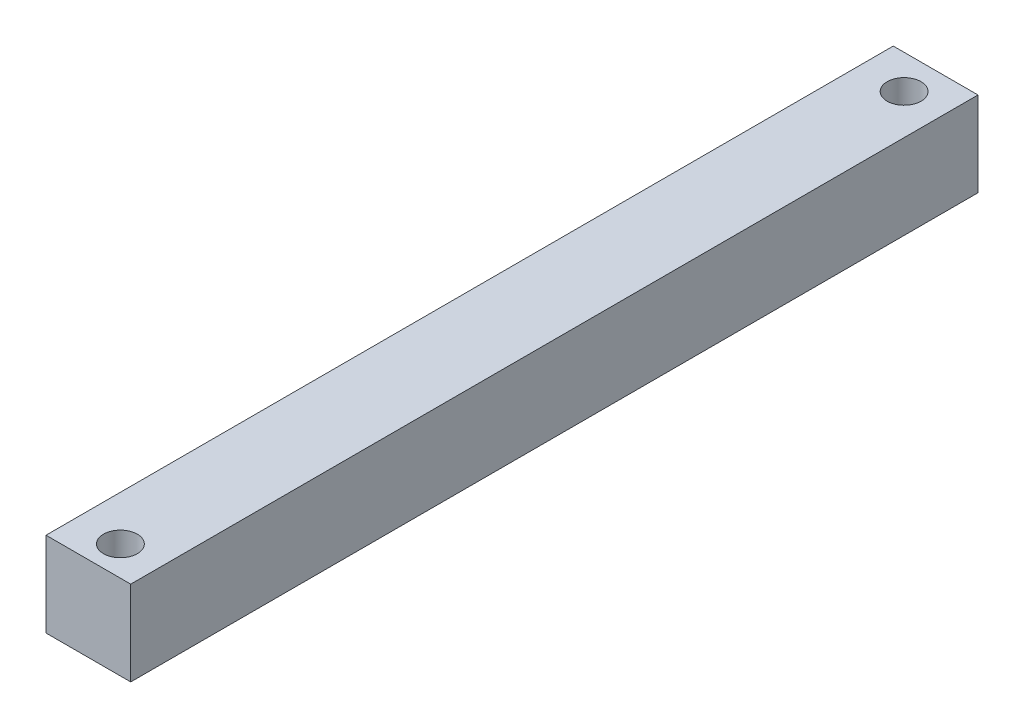
from build123d import *

# Parameters (mm, degrees)
SKETCH1_W           = 10
SKETCH1_H           = 100
BOSS_EXTRUDE1_DEPTH = 10
SKETCH2_R           = 2
CUT_EXTRUDE1_DEPTH  = 10


with BuildPart() as part:
    # Sketch1 → Boss-Extrude1 (new body)
    with BuildSketch(Plane(origin=(0, 0, 0), x_dir=(1, 0, 0), z_dir=(0, 1, 0))):
        with Locations((3.900422382, -15.339854308)):
            Rectangle(SKETCH1_W, SKETCH1_H)
    extrude(amount=BOSS_EXTRUDE1_DEPTH)

    # Sketch2 → Cut-Extrude1 (cut)
    with BuildSketch(Plane(origin=(0, 10, 0), x_dir=(1, 0, 0), z_dir=(0, 1, 0))):
        with Locations(Location((4.181335625, 30.660145692, 0), (0, 0, 270))):
            Circle(SKETCH2_R)
        with Locations(Location((4.181335625, -61.839854308, 0), (0, 0, 270))):
            Circle(SKETCH2_R)
    extrude(amount=-CUT_EXTRUDE1_DEPTH, mode=Mode.SUBTRACT)


solid = part.part
